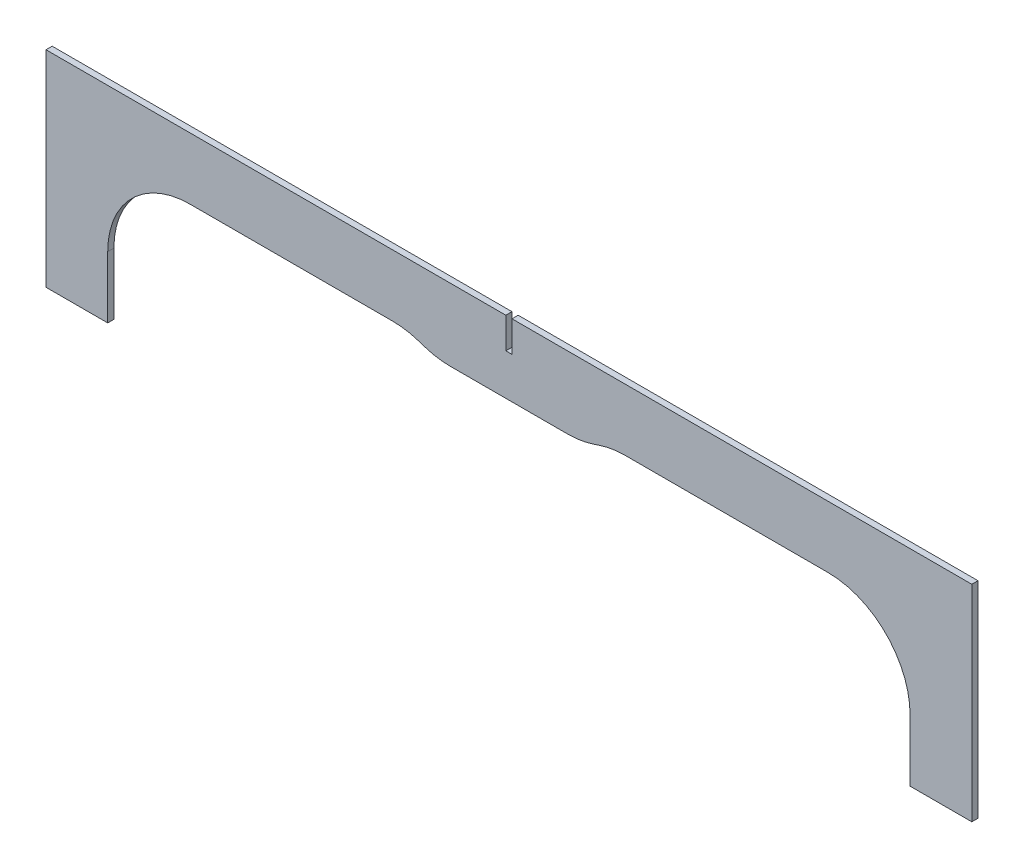
from build123d import *

# Parameters (mm, degrees)
BOSS_EXTRUDE1_DEPTH = 3
FILLET1_R           = 40


with BuildPart() as part:
    # Sketch1 → Boss-Extrude1 (new body)
    with BuildSketch(Plane.XY):
        Polygon((0, 0), (0, 100), (223.5, 100), (223.5, 85), (226.5, 85), (226.5, 100), (450, 100), (450, 0), (420, 0), (420, 70), (275, 70), (260, 65), (190, 65), (175, 70), (30, 70), (30, 0), align=None)
    extrude(amount=BOSS_EXTRUDE1_DEPTH)

    # Fillet1
    fillet1_edges = [part.edges().sort_by_distance(p)[0] for p in [
        (420, 70, 1.5),
        (275, 70, 1.5),
        (260, 65, 1.5),
        (190, 65, 1.5),
        (175, 70, 1.5),
        (30, 70, 1.5),
    ]]
    fillet(fillet1_edges, radius=FILLET1_R)


solid = part.part
